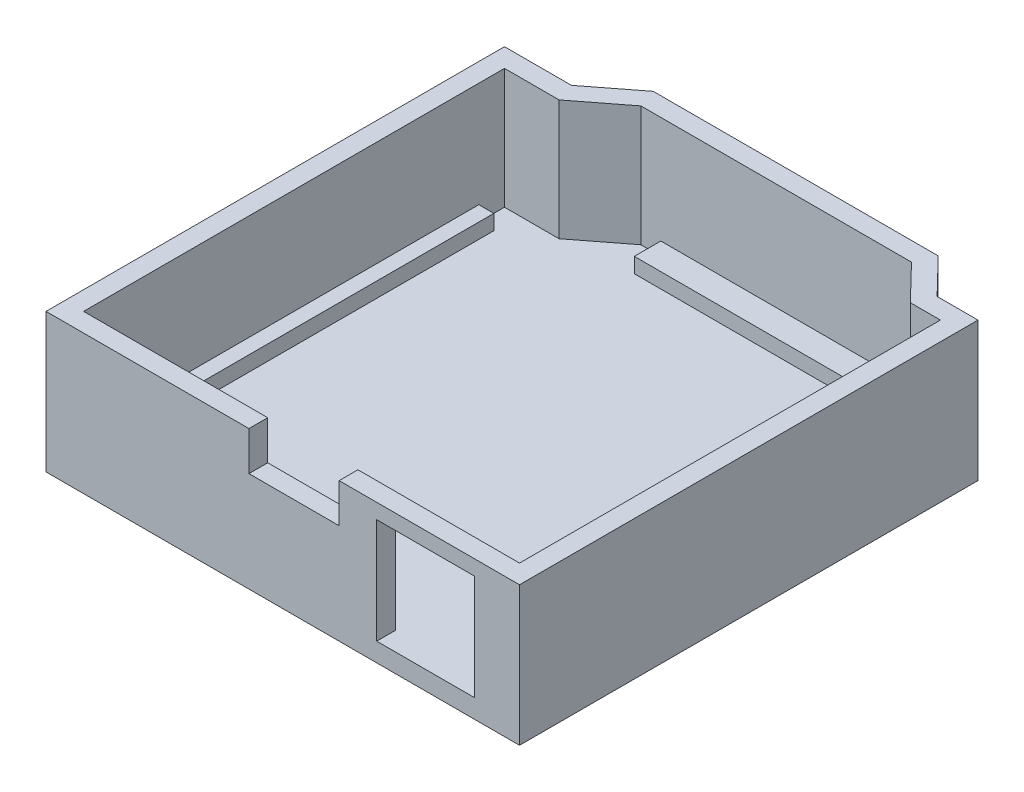
from build123d import *

# Parameters (mm, degrees)
BOSS_EXTRUDE1_DEPTH = 16
SHELL1_T            = 2.5
SKETCH2_W           = 13
SKETCH2_H           = 14
SKETCH2_W_2         = 12
SKETCH2_H_2         = 5.195244662
CUT_EXTRUDE1_DEPTH  = 4
SKETCH3_W           = 2
SKETCH3_H           = 50
SKETCH3_W_2         = 1.814522713
BOSS_EXTRUDE2_DEPTH = 2
SKETCH4_W           = 31.017616101
SKETCH4_H           = 3.530460369
BOSS_EXTRUDE3_DEPTH = 2


with BuildPart() as part:
    # Sketch1 → Boss-Extrude1 (new body)
    with BuildSketch(Plane(origin=(0, 0, 0), x_dir=(1, 0, 0), z_dir=(0, 1, 0))):
        Polygon((0, 0), (0, 56), (7.260584432, 56), (13.399361706, 60.750217247), (49.399361706, 60.750217247), (54, 56), (58, 56), (58, 0), align=None)
    extrude(amount=BOSS_EXTRUDE1_DEPTH)

    # Shell1
    shell1_openings = [part.faces().sort_by_distance(p)[0] for p in [
        (29.113999919, 16, -29.727085855),
    ]]
    offset(amount=SHELL1_T, openings=shell1_openings, kind=Kind.INTERSECTION)

    # Sketch2 → Cut-Extrude1 (cut)
    with BuildSketch(Plane(origin=(0, 0, 0), x_dir=(-1, 0, 0), z_dir=(0, 0, -1))):
        with Locations((-48, 7)):
            Rectangle(SKETCH2_W, SKETCH2_H)
        with Locations((-30.5, 13.402377669)):
            Rectangle(SKETCH2_W_2, SKETCH2_H_2)
    extrude(amount=-CUT_EXTRUDE1_DEPTH, mode=Mode.SUBTRACT)

    # Sketch3 → Boss-Extrude2 (add)
    with BuildSketch(Plane(origin=(0, 0, 0), x_dir=(1, 0, 0), z_dir=(0, 1, 0))):
        with Locations((1, 27.58353092)):
            Rectangle(SKETCH3_W, SKETCH3_H)
        with Locations((56.968981121, 27.58353092)):
            Rectangle(SKETCH3_W_2, SKETCH3_H)
    extrude(amount=BOSS_EXTRUDE2_DEPTH)

    # Sketch4 → Boss-Extrude3 (add)
    with BuildSketch(Plane(origin=(0, 0, 0), x_dir=(1, 0, 0), z_dir=(0, 1, 0))):
        with Locations((31.80262956, 58.741489624)):
            Rectangle(SKETCH4_W, SKETCH4_H)
    extrude(amount=BOSS_EXTRUDE3_DEPTH)


solid = part.part
